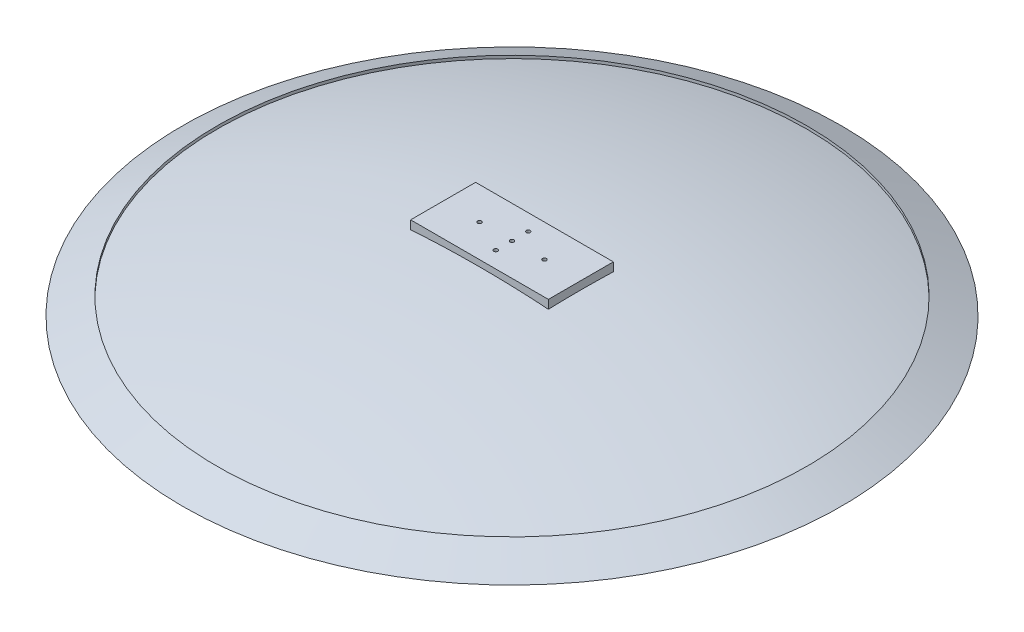
from build123d import *

# Parameters (mm, degrees)
SALIENTE_EXTRUIR4_START = 295
CROQUIS7_W              = 212
CROQUIS7_H              = 100
SALIENTE_EXTRUIR4_DEPTH = 14
CROQUIS8_R              = 3
CORTAR_EXTRUIR3_DEPTH   = 24


with BuildPart() as part:
    # Croquis1 → Revolución6 (revolve)
    with BuildSketch(Plane.XY, mode=Mode.PRIVATE) as revoluci_n6_sk:
        with BuildLine():
            Line((900, 235.378919011), (953.254169748, 208.811996198))
            ThreePointArc((953.254169748, 208.811996198), (703.404588333, 274.38194326), (446, 295.994652397))
            Line((446, 295.994652397), (446, 300))
            Line((446, 300), (450, 300))
            ThreePointArc((450, 300), (677.636548924, 282.626588725), (900, 230.908802125))
            Line((900, 230.908802125), (900, 235.378919011))
        make_face()
    revolve(revoluci_n6_sk.sketch.rotate(Axis((446, 295.994652397, 0), (0, 1, 0)), 90), axis=Axis((446, 295.994652397, 0), (0, 1, 0)))

    # Croquis7 → Saliente-Extruir4 (add)
    with BuildSketch(Plane(origin=(0, 0, 0), x_dir=(1, 0, 0), z_dir=(0, 1, 0)).offset(SALIENTE_EXTRUIR4_START)):
        with Locations((446, 0)):
            Rectangle(CROQUIS7_W, CROQUIS7_H)
    extrude(amount=SALIENTE_EXTRUIR4_DEPTH)

    # Croquis8 → Cortar-Extruir3 (cut)
    with BuildSketch(Plane(origin=(0, 309, 0), x_dir=(1, 0, 0), z_dir=(0, 1, 0))):
        with Locations(Location((446, 25, 0), (0, 0, 270))):
            Circle(CROQUIS8_R)
        with Locations(Location((496, 0, 0), (0, 0, 270))):
            Circle(CROQUIS8_R)
        with Locations(Location((446, -25, 0), (0, 0, 270))):
            Circle(CROQUIS8_R)
        with Locations(Location((446, 0, 0), (0, 0, 270))):
            Circle(CROQUIS8_R)
        with Locations(Location((396, 0, 0), (0, 0, 270))):
            Circle(CROQUIS8_R)
    extrude(amount=-CORTAR_EXTRUIR3_DEPTH, mode=Mode.SUBTRACT)


solid = part.part
